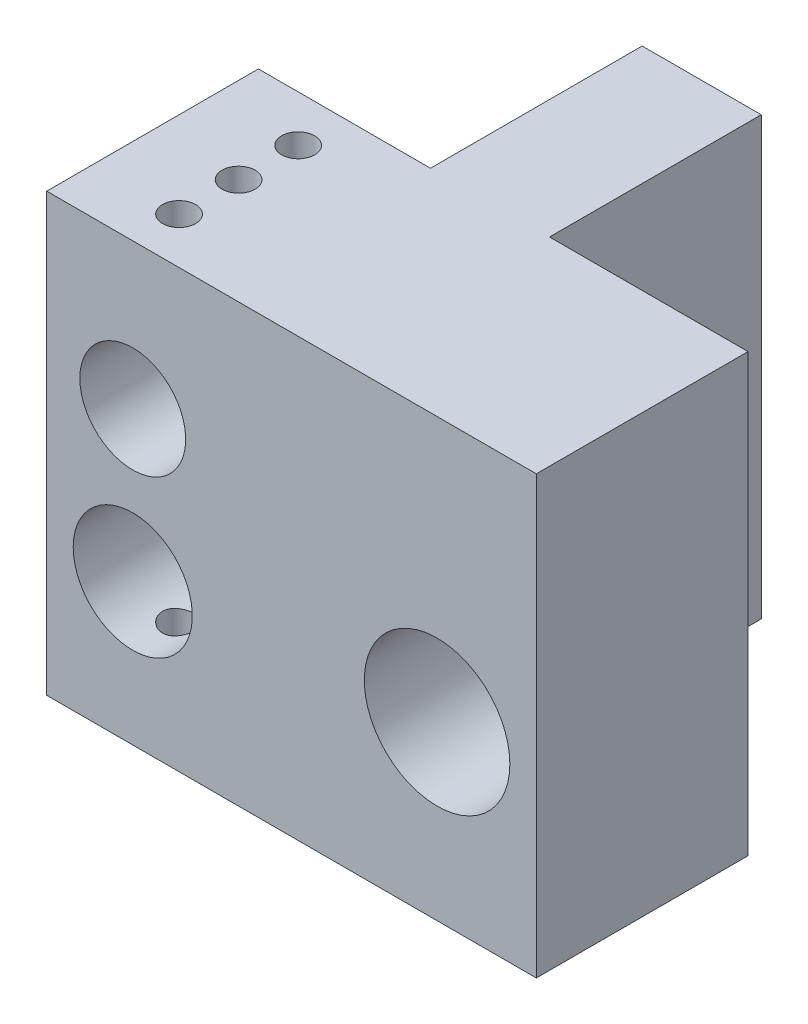
from build123d import *

# Parameters (mm, degrees)
ESQUISSE1_W             = 37
ESQUISSE1_H             = 16
BOSS_EXTRU_1_DEPTH      = 16.5
ESQUISSE3_R             = 5.5
ENL_V_MAT_EXTRU_2_DEPTH = 30.504236984
ESQUISSE14_R            = 4.5
ENL_V_MAT_EXTRU_3_DEPTH = 30.504236984
ESQUISSE15_R            = 4
ENL_V_MAT_EXTRU_4_DEPTH = 30.504236984
TROU_TARAUD_M34_REACH   = 40.668
TROU_TARAUD_M34_BORE_R  = 1.25
TROU_TARAUD_M35_REACH   = 40.668
TROU_TARAUD_M35_BORE_R  = 1.25
TROU_TARAUD_M36_REACH   = 41.444
TROU_TARAUD_M36_BORE_R  = 1.25
ESQUISSE18_W            = 9
ESQUISSE18_H            = 16
BOSS_EXTRU_2_DEPTH      = 33
ESQUISSE20_R            = 4.5
ENL_V_MAT_EXTRU_5_DEPTH = 38.73923692


with BuildPart() as part:
    # Esquisse1 → Boss.-Extru.1 (new, symmetric)
    with BuildSketch(Plane(origin=(0, 0, 0), x_dir=(1, 0, 0), z_dir=(0, 1, 0))):
        Rectangle(ESQUISSE1_W, ESQUISSE1_H)
    extrude(amount=BOSS_EXTRU_1_DEPTH, both=True)

    # Esquisse3 → Enlèv. mat.-Extru.2 (cut, through all)
    with BuildSketch(Plane.XY.offset(8)):
        with Locations((11, -3.5)):
            Circle(ESQUISSE3_R)
    extrude(amount=-ENL_V_MAT_EXTRU_2_DEPTH, mode=Mode.SUBTRACT)

    # Esquisse14 → Enlèv. mat.-Extru.3 (cut, through all)
    with BuildSketch(Plane(origin=(0, 0, -8), x_dir=(-1, 0, 0), z_dir=(0, 0, -1))):
        with Locations((12, -5.8)):
            Circle(ESQUISSE14_R)
    extrude(amount=-ENL_V_MAT_EXTRU_3_DEPTH, mode=Mode.SUBTRACT)

    # Esquisse15 → Enlèv. mat.-Extru.4 (cut, through all)
    with BuildSketch(Plane(origin=(0, 0, -8), x_dir=(-1, 0, 0), z_dir=(0, 0, -1))):
        with Locations((12, 5.5)):
            Circle(ESQUISSE15_R)
    extrude(amount=-ENL_V_MAT_EXTRU_4_DEPTH, mode=Mode.SUBTRACT)

    # Trou taraudé M34 bore → Trou taraudé M34 (cut, up to next)
    with BuildSketch(Plane(origin=(0, 16.5, 0), x_dir=(1, 0, 0), z_dir=(0, 1, 0)), mode=Mode.PRIVATE) as trou_taraud_m34_sk1:
        with Locations((-12, -4.5)):
            Circle(TROU_TARAUD_M34_BORE_R)
    trou_taraud_m34_tool1 = extrude(trou_taraud_m34_sk1.sketch, amount=-TROU_TARAUD_M34_REACH, mode=Mode.PRIVATE) & part.part
    # Trou taraudé M34 bore → Trou taraudé M34 (cut, up to next)
    with BuildSketch(Plane(origin=(0, 16.5, 0), x_dir=(1, 0, 0), z_dir=(0, 1, 0)), mode=Mode.PRIVATE) as trou_taraud_m34_sk2:
        with Locations((-12, 4.5)):
            Circle(TROU_TARAUD_M34_BORE_R)
    trou_taraud_m34_tool2 = extrude(trou_taraud_m34_sk2.sketch, amount=-TROU_TARAUD_M34_REACH, mode=Mode.PRIVATE) & part.part
    add(trou_taraud_m34_tool1.solids().sort_by_distance((-12, 16.5, 4.5))[0], mode=Mode.SUBTRACT)
    add(trou_taraud_m34_tool2.solids().sort_by_distance((-12, 16.5, -4.5))[0], mode=Mode.SUBTRACT)

    # Trou taraudé M35 bore → Trou taraudé M35 (cut, up to next)
    with BuildSketch(Plane(origin=(0, -16.5, 0), x_dir=(-1, 0, 0), z_dir=(0, -1, 0)), mode=Mode.PRIVATE) as trou_taraud_m35_sk1:
        with Locations((12, -4.5)):
            Circle(TROU_TARAUD_M35_BORE_R)
    trou_taraud_m35_tool1 = extrude(trou_taraud_m35_sk1.sketch, amount=-TROU_TARAUD_M35_REACH, mode=Mode.PRIVATE) & part.part
    # Trou taraudé M35 bore → Trou taraudé M35 (cut, up to next)
    with BuildSketch(Plane(origin=(0, -16.5, 0), x_dir=(-1, 0, 0), z_dir=(0, -1, 0)), mode=Mode.PRIVATE) as trou_taraud_m35_sk2:
        with Locations((12, 4.5)):
            Circle(TROU_TARAUD_M35_BORE_R)
    trou_taraud_m35_tool2 = extrude(trou_taraud_m35_sk2.sketch, amount=-TROU_TARAUD_M35_REACH, mode=Mode.PRIVATE) & part.part
    add(trou_taraud_m35_tool1.solids().sort_by_distance((-12, -16.5, 4.5))[0], mode=Mode.SUBTRACT)
    add(trou_taraud_m35_tool2.solids().sort_by_distance((-12, -16.5, -4.5))[0], mode=Mode.SUBTRACT)

    # Trou taraudé M36 bore → Trou taraudé M36 (cut, up to next)
    with BuildSketch(Plane(origin=(-1.446004376, 16.5, -0.30351444), x_dir=(-1, 0, 0), z_dir=(0, 1, 0)), mode=Mode.PRIVATE) as trou_taraud_m36_sk1:
        with Locations((10.553995624, 0.30351444)):
            Circle(TROU_TARAUD_M36_BORE_R)
    trou_taraud_m36_tool1 = extrude(trou_taraud_m36_sk1.sketch, amount=-TROU_TARAUD_M36_REACH, mode=Mode.PRIVATE) & part.part
    add(trou_taraud_m36_tool1.solids().sort_by_distance((-12, 16.5, 0))[0], mode=Mode.SUBTRACT)

    # Esquisse18 → Boss.-Extru.2 (add)
    with BuildSketch(Plane.XZ.offset(16.5)):
        with Locations((-1, -16)):
            Rectangle(ESQUISSE18_W, ESQUISSE18_H)
    extrude(amount=-BOSS_EXTRU_2_DEPTH)

    # Esquisse20 → Enlèv. mat.-Extru.5 (cut, through all)
    with BuildSketch(Plane.ZY.offset(5.5)):
        with Locations((-17.1, -3.55)):
            Circle(ESQUISSE20_R)
    extrude(amount=-ENL_V_MAT_EXTRU_5_DEPTH, mode=Mode.SUBTRACT)


solid = part.part
